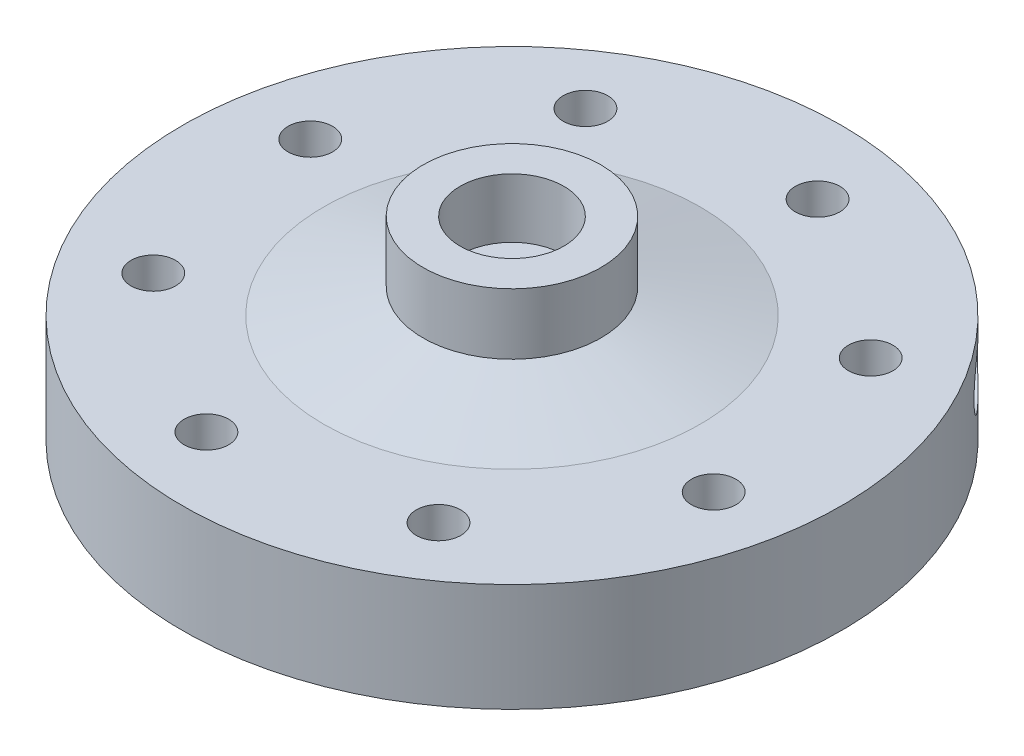
from build123d import *

# Parameters (mm, degrees)
SKETCH1_R            = 44.45
BODY_EXTRUSION_DEPTH = 21.189302622
SKETCH6_R            = 3.81
DE_DEPTH             = 100
SKETCH7_R            = 7
INLET_TAP_DEPTH      = 8
BASE_START           = 5
SKETCH26_R           = 44.45
SKETCH26_R_2         = 22.09
BASE_RISER_DEPTH     = 5
SKETCH13_R           = 3
BOLT_HOLES_DEPTH     = 100
BOLT_PATTERN_COUNT   = 8


with BuildPart() as part:
    # Sketch1 → body extrusion (new body)
    with BuildSketch(Plane(origin=(0, 0, 0), x_dir=(1, 0, 0), z_dir=(0, 1, 0))):
        with Locations(Location((0, 0, 0), (0, 0, 270))):
            Circle(SKETCH1_R)
    extrude(amount=BODY_EXTRUSION_DEPTH)

    # Sketch2 → main chamber (revolve, cut)
    with BuildSketch(Plane.XY, mode=Mode.PRIVATE) as main_chamber_sk:
        Polygon((0, 0), (0, 9.189302622), (3.81, 9.189302622), (22.09, 4.5875), (22.09, 0), align=None)
    revolve(main_chamber_sk.sketch.rotate(Axis((0, 0, 0), (0, 1, 0)), 90), axis=Axis((0, 0, 0), (0, 1, 0)), mode=Mode.SUBTRACT)

    # Sketch6 → De (cut)
    with BuildSketch(Plane(origin=(0, 21.189302622, 0), x_dir=(1, 0, 0), z_dir=(0, 1, 0))):
        with Locations(Location((0, 0, 0), (0, 0, 270))):
            Circle(SKETCH6_R)
    extrude(amount=-DE_DEPTH, mode=Mode.SUBTRACT)

    # Sketch7 → inlet tap (cut)
    with BuildSketch(Plane(origin=(0, 21.189302622, 0), x_dir=(1, 0, 0), z_dir=(0, 1, 0))):
        with Locations(Location((0, 0, 0), (0, 0, 270))):
            Circle(SKETCH7_R)
    extrude(amount=-INLET_TAP_DEPTH, mode=Mode.SUBTRACT)

    # Sketch11 → conical outlet (revolve, cut)
    with BuildSketch(Plane(origin=(-5.360707244, 0, -20.006431798), x_dir=(0.9659258262890693, 0, -0.2588190451025173), z_dir=(0.2588190451025173, 0, 0.9659258262890693)), mode=Mode.PRIVATE) as conical_outlet_sk:
        Polygon((5.54981252, 4.401182844), (105.169282329, 13.116757119), (105.169282329, 3.79375), (5.54981252, 3.79375), align=None)
    revolve(conical_outlet_sk.sketch.rotate(Axis((0, 3.79375, -21.442828975), (0.9659258262890692, 0, -0.2588190451025173)), 255.191029346), axis=Axis((0, 3.79375, -21.442828975), (0.9659258262890692, 0, -0.2588190451025173)), mode=Mode.SUBTRACT)

    # Sketch16 → outer profile (revolve, cut)
    with BuildSketch(Plane.XY, mode=Mode.PRIVATE) as outer_profile_sk:
        Polygon((12, 21.189302622), (12, 12.956212983), (25.4, 9.582900339), (44.45, 9.582900339), (44.45, 21.189302622), align=None)
    revolve(outer_profile_sk.sketch.rotate(Axis((0, 0, 0), (0, 1, 0)), 90), axis=Axis((0, 0, 0), (0, 1, 0)), mode=Mode.SUBTRACT)

    # Sketch26 → base riser (add)
    with BuildSketch(Plane.XZ.offset(BASE_START)):
        with Locations(Location((0, 0, 0), (0, 0, 270))):
            Circle(SKETCH26_R)
        with Locations(Location((0, 0, 0), (0, 0, 270))):
            Circle(SKETCH26_R_2, mode=Mode.SUBTRACT)
    extrude(amount=-BASE_RISER_DEPTH)

    # Sketch13 → bolt holes (cut)
    with BuildSketch(Plane(origin=(0, 21.189302622, 0), x_dir=(1, 0, 0), z_dir=(0, 1, 0))):
        with Locations(Location((7.007261141, 34.214820127, 0), (0, 0, 90))):
            Circle(SKETCH13_R)
    bolt_holes = extrude(amount=-BOLT_HOLES_DEPTH, mode=Mode.SUBTRACT)

    # bolt pattern: bolt holes ×8 about axis
    bolt_pattern_axis = Axis((0, 0, 0), (0, 1, 0))
    for i in range(1, BOLT_PATTERN_COUNT):
        add(bolt_holes.rotate(bolt_pattern_axis, i * 360 / BOLT_PATTERN_COUNT), mode=Mode.SUBTRACT)


solid = part.part
